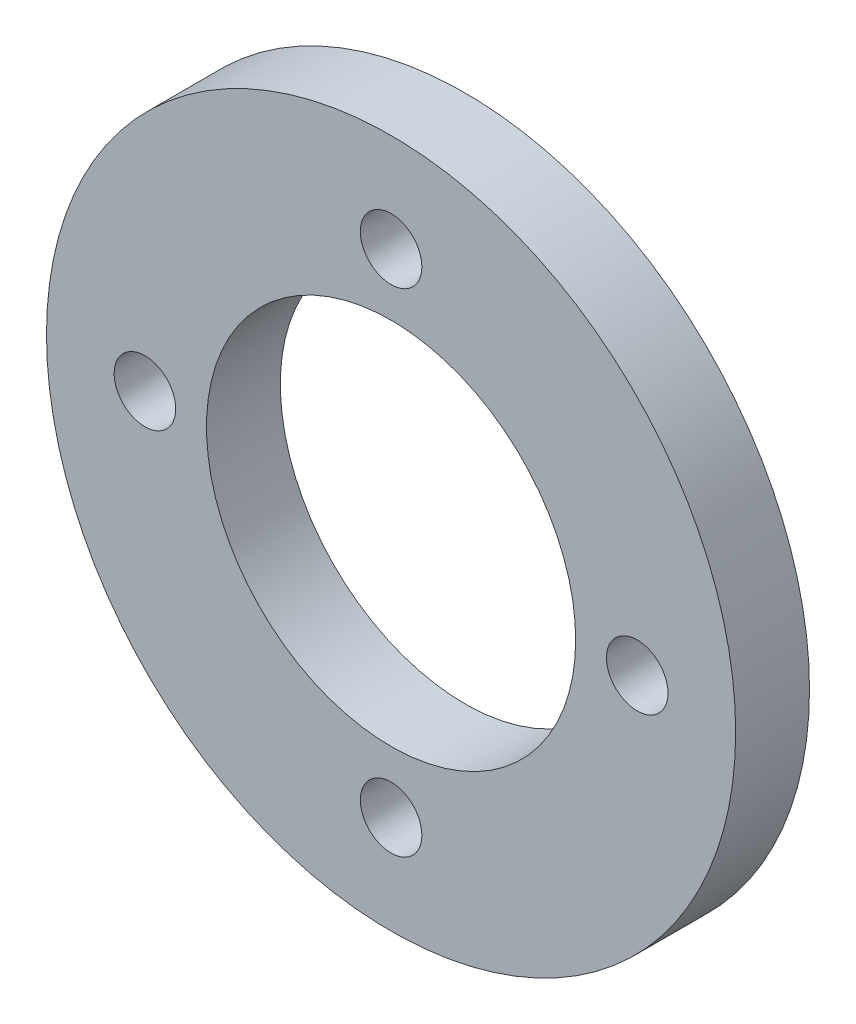
from build123d import *

# Parameters (mm, degrees)
SKETCH_1_R          = 14
EXTRUDE_1_DEPTH     = 3
SKETCH_3_R          = 1.25
CUT_EXTRUDE_1_DEPTH = 3
SKETCH_7_R          = 7.5
CUT_EXTRUDE_2_DEPTH = 10


with BuildPart() as part:
    # 草图1 → 凸台-拉伸1 (new body)
    with BuildSketch(Plane.XY):
        Circle(SKETCH_1_R)
    extrude(amount=EXTRUDE_1_DEPTH)

    # 草图3 → 切除-拉伸1 (cut)
    with BuildSketch(Plane.XY.offset(3)):
        with Locations((10, 0)):
            Circle(SKETCH_3_R)
        with Locations((0, 10)):
            Circle(SKETCH_3_R)
        with Locations((-10, 0)):
            Circle(SKETCH_3_R)
        with Locations((0, -10)):
            Circle(SKETCH_3_R)
    extrude(amount=-CUT_EXTRUDE_1_DEPTH, mode=Mode.SUBTRACT)

    # 草图7 → 切除-拉伸2 (cut)
    with BuildSketch(Plane.XY.offset(3)):
        Circle(SKETCH_7_R)
    extrude(amount=-CUT_EXTRUDE_2_DEPTH, mode=Mode.SUBTRACT)


solid = part.part
